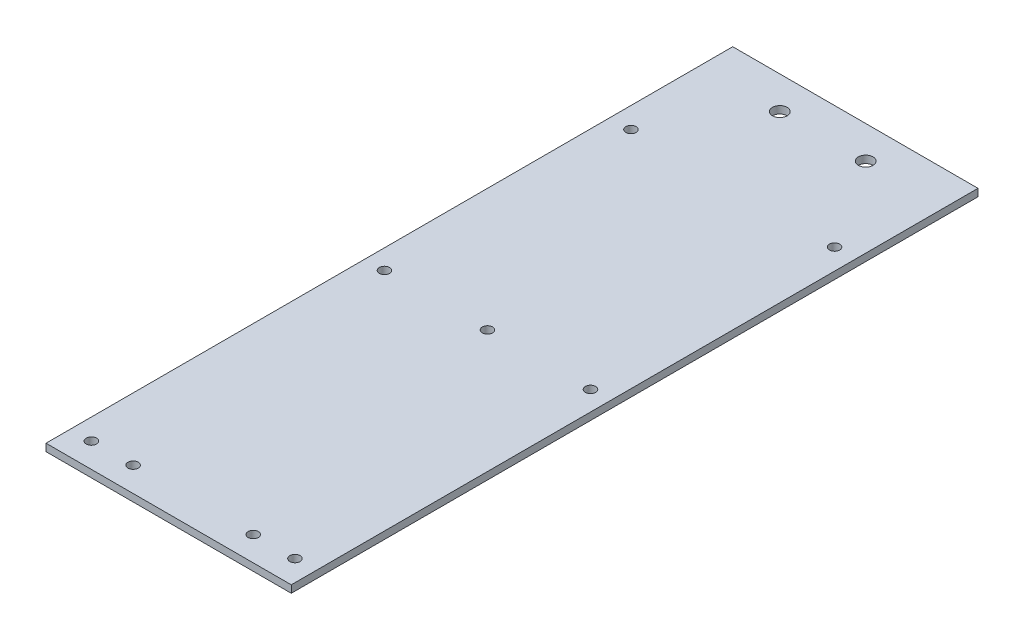
from build123d import *

# Parameters (mm, degrees)
SKETCH1_R             = 2.1
BOSS_EXTRUDE1_DEPTH   = 3
BOSS_EXTRUDE1_2_DEPTH = 3
BOSS_EXTRUDE1_3_DEPTH = 3
SKETCH1_W             = 100
SKETCH1_H             = 120
BOSS_EXTRUDE1_4_DEPTH = 3
SKETCH2_R             = 2.1
CUT_EXTRUDE1_DEPTH    = 10
SKETCH3_W             = 100
SKETCH3_H             = 3
BOSS_EXTRUDE2_DEPTH   = 160
SKETCH4_R             = 3
SKETCH4_R_2           = 2.1
CUT_EXTRUDE2_DEPTH    = 160
SKETCH5_R             = 2.1
CUT_EXTRUDE3_DEPTH    = 10


with BuildPart() as part:
    # Sketch1 → Boss-Extrude1 (new body)
    with BuildSketch(Plane(origin=(0, 0, 0), x_dir=(1, 0, 0), z_dir=(0, 1, 0))):
        with Locations(Location((-42, 70, 0), (0, 0, 270))):
            Circle(SKETCH1_R)
    extrude(amount=BOSS_EXTRUDE1_DEPTH)


with BuildPart() as body_2:
    # Sketch1 → Boss-Extrude1 2 (new body)
    with BuildSketch(Plane(origin=(0, 0, 0), x_dir=(1, 0, 0), z_dir=(0, 1, 0))):
        with Locations(Location((0, 70, 0), (0, 0, 270))):
            Circle(SKETCH1_R)
    extrude(amount=BOSS_EXTRUDE1_2_DEPTH)


with BuildPart() as body_3:
    # Sketch1 → Boss-Extrude1 3 (new body)
    with BuildSketch(Plane(origin=(0, 0, 0), x_dir=(1, 0, 0), z_dir=(0, 1, 0))):
        with Locations(Location((42, 70, 0), (0, 0, 270))):
            Circle(SKETCH1_R)
    extrude(amount=BOSS_EXTRUDE1_3_DEPTH)


with BuildPart() as body_4:
    # Sketch1 → Boss-Extrude1 4 (new body)
    with BuildSketch(Plane(origin=(0, 0, 0), x_dir=(1, 0, 0), z_dir=(0, 1, 0))):
        Rectangle(SKETCH1_W, SKETCH1_H)
        with Locations(Location((41.5, -50, 0), (0, 0, 90))):
            Circle(SKETCH1_R, mode=Mode.SUBTRACT)
        with Locations(Location((-41.5, -50, 0), (0, 0, 270))):
            Circle(SKETCH1_R, mode=Mode.SUBTRACT)
    extrude(amount=BOSS_EXTRUDE1_4_DEPTH)

    # Sketch2 → Cut-Extrude1 (cut)
    with BuildSketch(Plane.XZ):
        with Locations(Location((24.5, 50, 0), (0, 0, 270))):
            Circle(SKETCH2_R)
        with Locations(Location((-24.5, 50, 0), (0, 0, 270))):
            Circle(SKETCH2_R)
    extrude(amount=-CUT_EXTRUDE1_DEPTH, mode=Mode.SUBTRACT)

    # Sketch3 → Boss-Extrude2 (add)
    with BuildSketch(Plane(origin=(0, 0, -60), x_dir=(-1, 0, 0), z_dir=(0, 0, -1))):
        with Locations((0, 1.5)):
            Rectangle(SKETCH3_W, SKETCH3_H)
    extrude(amount=BOSS_EXTRUDE2_DEPTH)

    # Sketch4 → Cut-Extrude2 (cut)
    with BuildSketch(Plane.XZ):
        with Locations(Location((17.5, -206.7, 0), (0, 0, 270))):
            Circle(SKETCH4_R)
        with Locations(Location((-17.5, -206.7, 0), (0, 0, 270))):
            Circle(SKETCH4_R)
        with Locations(Location((-41.5, -170, 0), (0, 0, 270))):
            Circle(SKETCH4_R_2)
        with Locations(Location((41.5, -170, 0), (0, 0, 270))):
            Circle(SKETCH4_R_2)
    extrude(amount=-CUT_EXTRUDE2_DEPTH, mode=Mode.SUBTRACT)


with BuildPart() as cut_extrude3_tool:
    # Sketch5 → Cut-Extrude3 (new body)
    with BuildSketch(Plane.XZ):
        with Locations(Location((-42, -70, 0), (0, 0, 270))):
            Circle(SKETCH5_R)
        with Locations(Location((0, -70, 0), (0, 0, 270))):
            Circle(SKETCH5_R)
        with Locations(Location((42, -70, 0), (0, 0, 270))):
            Circle(SKETCH5_R)
    extrude(amount=-CUT_EXTRUDE3_DEPTH)


with BuildPart() as part_1:
    add(part.part)

    # Cut-Extrude3: cut by cut_extrude3_tool
    add(cut_extrude3_tool.part, mode=Mode.SUBTRACT)


with BuildPart() as body_2_1:
    add(body_2.part)

    # Cut-Extrude3: cut by cut_extrude3_tool
    add(cut_extrude3_tool.part, mode=Mode.SUBTRACT)


with BuildPart() as body_3_1:
    add(body_3.part)

    # Cut-Extrude3: cut by cut_extrude3_tool
    add(cut_extrude3_tool.part, mode=Mode.SUBTRACT)


with BuildPart() as body_4_1:
    add(body_4.part)

    # Cut-Extrude3: cut by cut_extrude3_tool
    add(cut_extrude3_tool.part, mode=Mode.SUBTRACT)


solid = body_4_1.part
